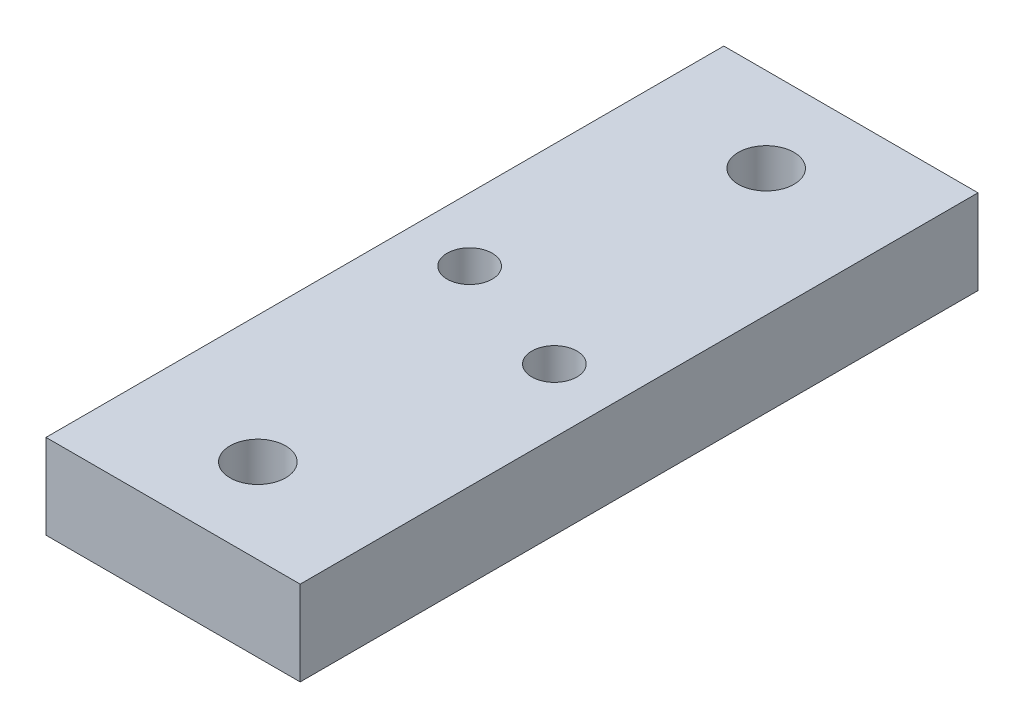
from build123d import *

# Parameters (mm, degrees)
SKETCH1_W                                    = 38.1
SKETCH1_H                                    = 101.6
SKETCH1_R                                    = 4.1656
BOSS_EXTRUDE1_DEPTH                          = 12.7
CBORE_FOR_1_4_HEX_MACHINE_SCREW1_D           = 6.7564
CBORE_FOR_1_4_HEX_MACHINE_SCREW1_CBORE_D     = 15.875
CBORE_FOR_1_4_HEX_MACHINE_SCREW1_CBORE_DEPTH = 4.826


with BuildPart() as part:
    # Sketch1 → Boss-Extrude1 (new body)
    with BuildSketch(Plane(origin=(0, 0, 0), x_dir=(1, 0, 0), z_dir=(0, 1, 0))):
        with Locations((19.05, 50.8)):
            Rectangle(SKETCH1_W, SKETCH1_H)
        with Locations(Location((19.05, 88.9, 0), (0, 0, 270))):
            Circle(SKETCH1_R, mode=Mode.SUBTRACT)
        with Locations(Location((19.05, 12.7, 0), (0, 0, 270))):
            Circle(SKETCH1_R, mode=Mode.SUBTRACT)
    extrude(amount=BOSS_EXTRUDE1_DEPTH)

    # CBORE for 1/4 Hex Machine Screw1 (through all)
    with Locations(Plane(origin=(0, 0, 0), x_dir=(-1, 0, 0), z_dir=(0, -1, 0))):
        with Locations((-28.575, 47.625), (-9.525, 53.975)):
            CounterBoreHole(CBORE_FOR_1_4_HEX_MACHINE_SCREW1_D / 2, CBORE_FOR_1_4_HEX_MACHINE_SCREW1_CBORE_D / 2, CBORE_FOR_1_4_HEX_MACHINE_SCREW1_CBORE_DEPTH)


solid = part.part
